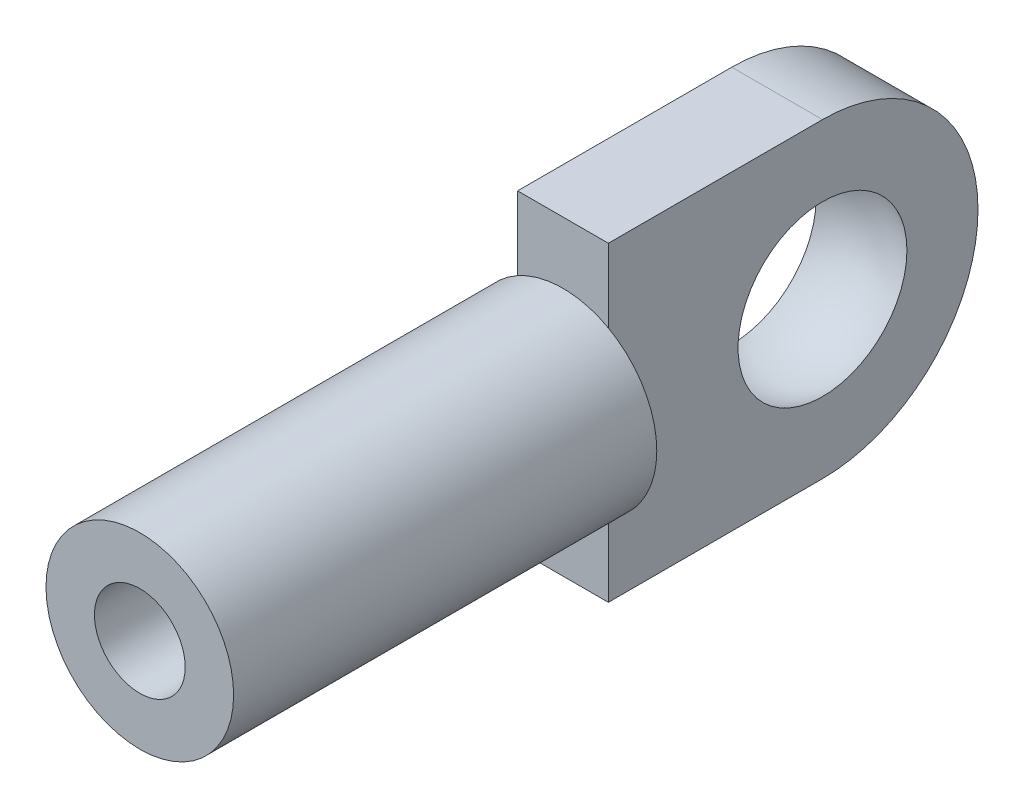
from build123d import *

# Parameters (mm, degrees)
SKETCH1_R           = 2.3368
EXTRUDE1_DEPTH      = 10.541
EXTRUDE2_DEPTH      = 1.1303
EXTRUDE2_DEPTH_BACK = 1.1303
SKETCH4_R           = 1.1303
EXTRUDE3_DEPTH      = 8.001


with BuildPart() as part:
    # Sketch1 → Extrude1 (new body)
    with BuildSketch(Plane.XY):
        Circle(SKETCH1_R)
    extrude(amount=EXTRUDE1_DEPTH)

    # Sketch2 → Extrude2 (add, two sides: drawn at the far end of the back side and taken through both)
    with BuildSketch(Plane(origin=(0, 0, 0), x_dir=(0, 0, -1), z_dir=(1, 0, 0)).offset(-EXTRUDE2_DEPTH_BACK)):
        with BuildLine():
            Line((0, 0), (0, 3.8735))
            Line((0, 3.8735), (5.334, 3.8735))
            ThreePointArc((5.334, 3.8735), (9.2075, 0), (5.334, -3.8735))
            Line((5.334, -3.8735), (0, -3.8735))
            Line((0, -3.8735), (0, 0))
        make_face()
    extrude(amount=EXTRUDE2_DEPTH + EXTRUDE2_DEPTH_BACK)

    # Sketch3 → Cut-Revolve1 (revolve, cut)
    with BuildSketch(Plane(origin=(0, 0, 0), x_dir=(0, 0, -1), z_dir=(1, 0, 0))):
        with BuildLine():
            Line((5.334, 2.3876), (5.334, -2.3876))
            ThreePointArc((5.334, -2.3876), (2.9464, 0), (5.334, 2.3876))
        make_face()
    revolve(axis=Axis((0, 2.3876, -5.334), (0, -1, 0)), mode=Mode.SUBTRACT)

    # Sketch4 → Extrude3 (cut)
    with BuildSketch(Plane.XY.offset(10.541)):
        Circle(SKETCH4_R)
    extrude(amount=-EXTRUDE3_DEPTH, mode=Mode.SUBTRACT)


solid = part.part
